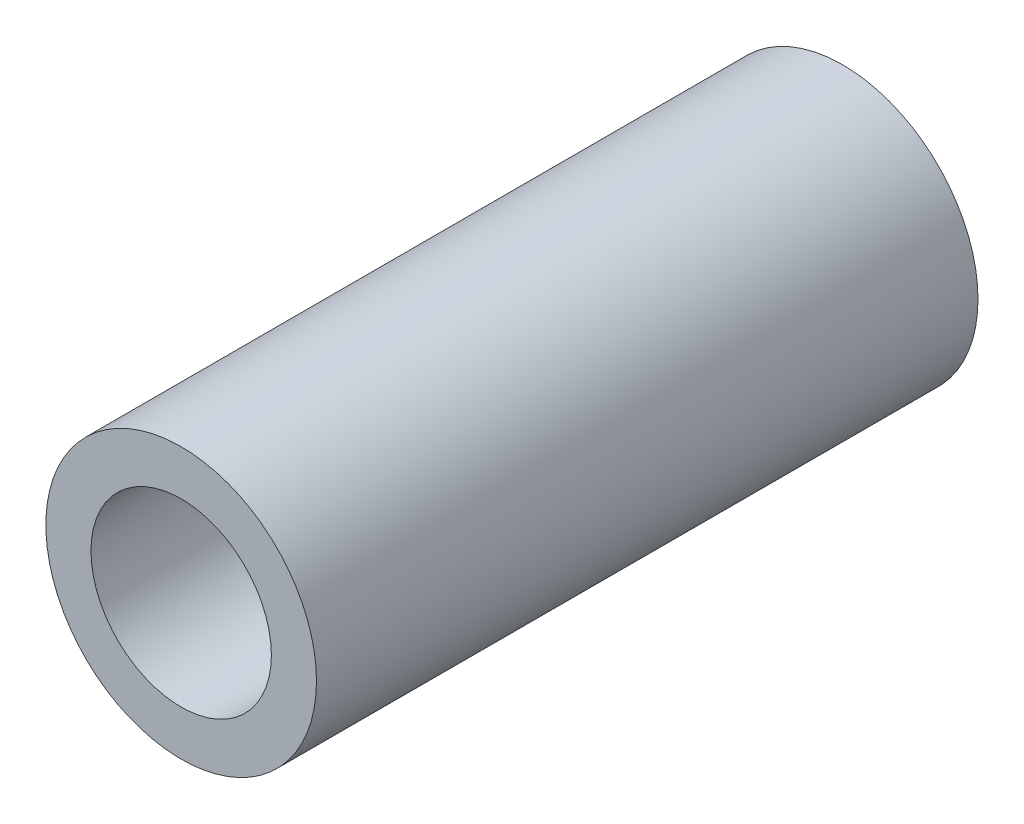
from build123d import *

# Parameters (mm, degrees)
CROQUIS1_R              = 4.5
CROQUIS1_R_2            = 3
SALIENTE_EXTRUIR1_DEPTH = 22


with BuildPart() as part:
    # Croquis1 → Saliente-Extruir1 (new body)
    with BuildSketch(Plane.XY):
        Circle(CROQUIS1_R)
        Circle(CROQUIS1_R_2, mode=Mode.SUBTRACT)
    extrude(amount=SALIENTE_EXTRUIR1_DEPTH)


solid = part.part
